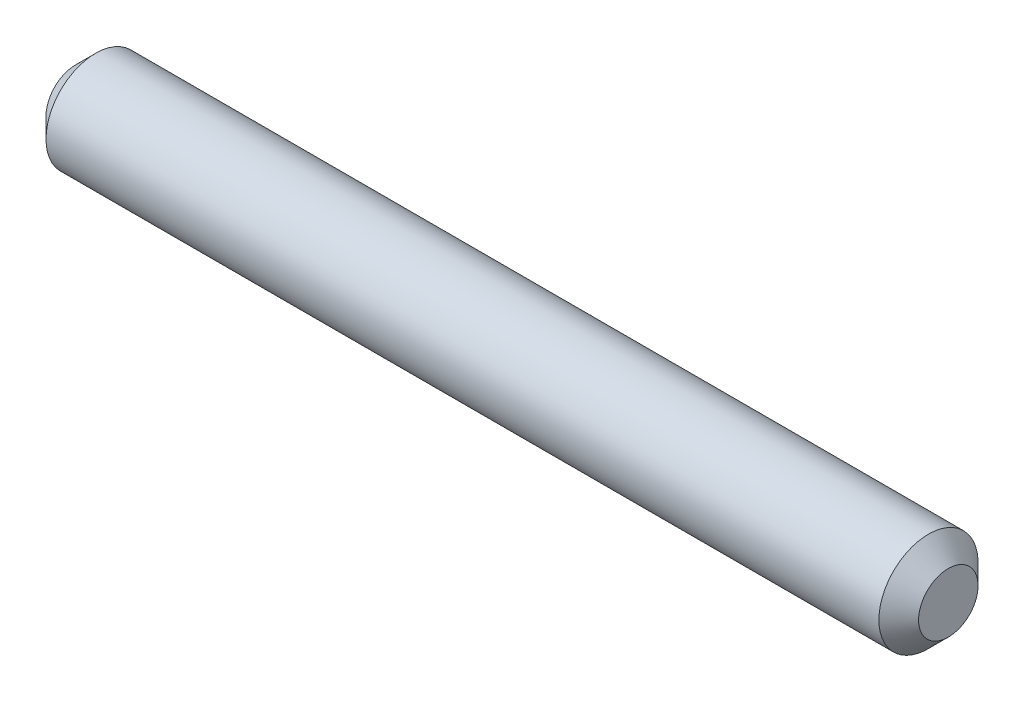
from build123d import *


with BuildPart() as part:
    # Sketch2 → Revolve1 (revolve)
    with BuildSketch(Plane.XY, mode=Mode.PRIVATE) as revolve1_sk:
        Polygon((0, 1.5), (1, 2.5), (43, 2.5), (44, 1.5), (44, 0), (0, 0), align=None)
    revolve(revolve1_sk.sketch.rotate(Axis((0, 0, 0), (1, 0, 0)), 90), axis=Axis((0, 0, 0), (1, 0, 0)))


solid = part.part
